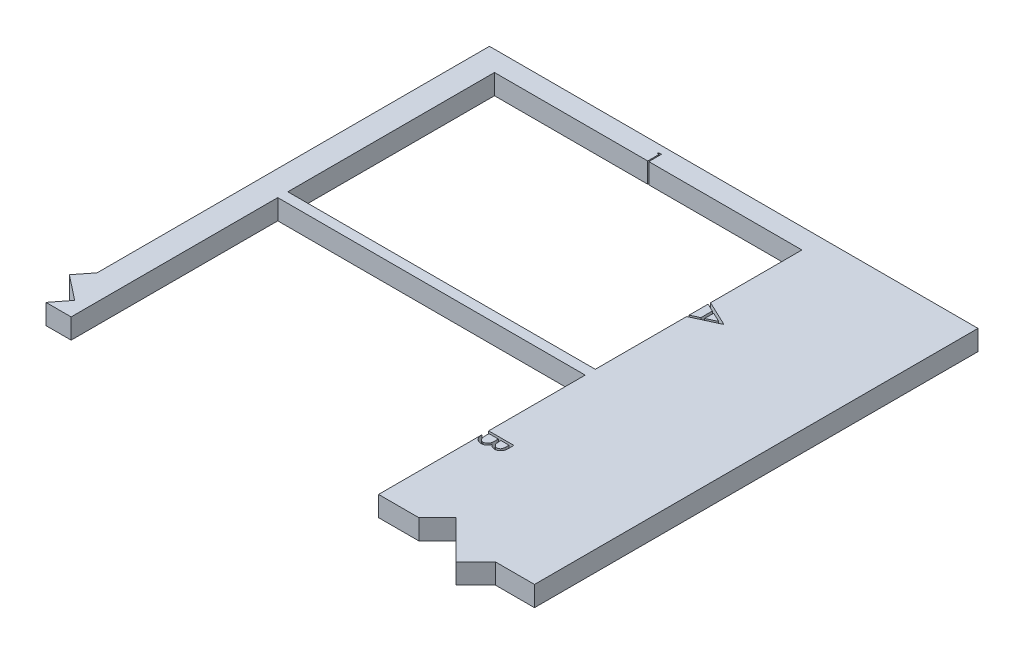
from build123d import *

# Parameters (mm, degrees)
SKETCH1_W           = 77.47
SKETCH1_H           = 52.07
BOSS_EXTRUDE4_DEPTH = 5.08
CUT_EXTRUDE9_DEPTH  = 5.08
CUT_EXTRUDE20_DEPTH = 5.08


with BuildPart() as part:
    # Sketch1 → Boss-Extrude4 (new body)
    with BuildSketch(Plane(origin=(0, 0, 0), x_dir=(1, 0, 0), z_dir=(0, 1, 0))):
        Polygon((-146.05, -110.49), (-151.207591036, -110.49), (-151.207591036, 110.49), (151.052408964, 110.49), (151.052408964, -110.49), (111.76, -110.49), (111.76, -58.42), (34.29, -58.42), (34.29, -110.49), (21.59, -110.49), (21.59, -58.42), (-55.88, -58.42), (-55.88, -110.49), (-68.58, -110.49), (-68.58, -58.42), (-146.05, -58.42), align=None)
        with Locations((-107.315, 79.375)):
            Rectangle(SKETCH1_W, SKETCH1_H, mode=Mode.SUBTRACT)
        with Locations((-107.315, 24.765)):
            Rectangle(SKETCH1_W, SKETCH1_H, mode=Mode.SUBTRACT)
        with Locations((-107.315, -29.845)):
            Rectangle(SKETCH1_W, SKETCH1_H, mode=Mode.SUBTRACT)
        with Locations((-17.145, 79.375)):
            Rectangle(SKETCH1_W, SKETCH1_H, mode=Mode.SUBTRACT)
        with Locations((73.025, 79.375)):
            Rectangle(SKETCH1_W, SKETCH1_H, mode=Mode.SUBTRACT)
        with Locations((-17.145, 24.765)):
            Rectangle(SKETCH1_W, SKETCH1_H, mode=Mode.SUBTRACT)
        with Locations((-17.145, -29.845)):
            Rectangle(SKETCH1_W, SKETCH1_H, mode=Mode.SUBTRACT)
        with Locations((73.025, 24.765)):
            Rectangle(SKETCH1_W, SKETCH1_H, mode=Mode.SUBTRACT)
        with Locations((73.025, -29.845)):
            Rectangle(SKETCH1_W, SKETCH1_H, mode=Mode.SUBTRACT)
    extrude(amount=BOSS_EXTRUDE4_DEPTH)

    # Sketch8 → Cut-Extrude9 (cut)
    # profile 1 of 7: a face of its own
    with BuildSketch(Plane(origin=(0, 5.08, 0), x_dir=(1, 0, 0), z_dir=(0, 1, 0))):
        Polygon((118.11, 79.293589744), (111.76, 76.362820513), (111.76, 76.982301683), (113.79525641, 77.921063702), (113.79525641, 80.799679487), (111.76, 81.765154247), (111.76, 82.387179487), (118.11, 79.375), align=None)
        Polygon((116.872309696, 79.340655048), (114.446538462, 80.49057492), (114.446538462, 78.221264022), align=None, mode=Mode.SUBTRACT)
    # profile 2 of 7: a face of its own
    with BuildSketch(Plane(origin=(0, 5.08, 0), x_dir=(1, 0, 0), z_dir=(0, 1, 0))):
        with BuildLine():
            Line((118.11, 26.474615385), (118.11, 25.235653045))
            add(Edge.make_bspline(
                [(118.11, 25.235653045), (118.109681139, 25.175004234), (118.109063106, 25.057451746), (118.099477996, 24.886510758), (118.086408481, 24.726402202), (118.065671027, 24.577079644), (118.040648803, 24.438612083), (118.010346937, 24.310582227), (117.974012938, 24.193397201), (117.916234684, 24.053492664), (117.830376936, 23.893979465), (117.703506539, 23.721262382), (117.548326213, 23.573571833), (117.37327911, 23.4462338), (117.180718496, 23.344994626), (116.975233967, 23.271753187), (116.75947595, 23.225383899), (116.611351899, 23.220615168), (116.536492388, 23.218205128)],
                knots=[0, 0, 0, 0, 1.001505555, 1.941167018, 2.826882275, 3.653841531, 4.429895133, 5.150066043, 5.825578002, 6.45369114, 7.647487171, 8.808567382, 9.977351308, 11.170798116, 12.373658725, 13.556498008, 14.765093433, 16, 16, 16, 16], degree=3))
            add(Edge.make_bspline(
                [(116.536492388, 23.218205128), (116.466353726, 23.220150205), (116.328524642, 23.223972465), (116.12725909, 23.261767034), (115.934882118, 23.318037757), (115.753765338, 23.399726219), (115.586236491, 23.504802861), (115.433291194, 23.631250472), (115.29863595, 23.781802882), (115.223670167, 23.894781468), (115.185590946, 23.952169471)],
                knots=[0, 0, 0, 0, 1.044266239, 2.052081639, 3.041743201, 4.026043445, 5.00270663, 5.980942822, 6.97441044, 8, 8, 8, 8], degree=3))
            add(Edge.make_bspline(
                [(115.185590946, 23.952169471), (115.157917248, 23.880020614), (115.10497061, 23.741981978), (115.010852235, 23.551885993), (114.90963819, 23.387448746), (114.798522364, 23.248489243), (114.677253559, 23.131437365), (114.548260115, 23.026322349), (114.405191505, 22.938259533), (114.252121508, 22.862606152), (114.090124446, 22.803067733), (113.919941192, 22.760940396), (113.743474705, 22.735055197), (113.623194862, 22.731525492), (113.562473958, 22.72974359)],
                knots=[0, 0, 0, 0, 1.272302504, 2.434229863, 3.488457646, 4.447234501, 5.35599188, 6.26022912, 7.18267843, 8.11661068, 9.06895546, 10.019249207, 11.000057067, 12, 12, 12, 12], degree=3))
            add(Edge.make_bspline(
                [(113.562473958, 22.72974359), (113.500485842, 22.731516424), (113.378522486, 22.735004524), (113.199347436, 22.7607231), (113.028142769, 22.804311677), (112.863691196, 22.864204763), (112.70692357, 22.942816916), (112.555876508, 23.036423505), (112.414573802, 23.150354586), (112.279655118, 23.277346904), (112.158418428, 23.421179366), (112.05048411, 23.576340817), (111.961311987, 23.745062992), (111.887341532, 23.924729456), (111.830014808, 24.116534097), (111.790215937, 24.31976575), (111.763336967, 24.53446858), (111.761131196, 24.681807332), (111.76, 24.757367788)],
                knots=[0, 0, 0, 0, 0.978404568, 1.925038397, 2.85041836, 3.763147166, 4.682162379, 5.614488577, 6.562659439, 7.54271123, 8.535210642, 9.526693784, 10.520907202, 11.541451354, 12.589717429, 13.675358278, 14.807842563, 16, 16, 16, 16], degree=3))
            Line((111.76, 24.757367788), (111.76, 26.474615385))
            Line((111.76, 26.474615385), (118.11, 26.474615385))
        make_face()
        with BuildLine():
            Line((117.458717949, 25.90474359), (115.423461538, 25.90474359))
            Line((115.423461538, 25.90474359), (115.423461538, 25.521860978))
            add(Edge.make_bspline(
                [(115.423461538, 25.521860978), (115.424181075, 25.465891945), (115.425571367, 25.357748368), (115.429679415, 25.200723225), (115.440678409, 25.055331233), (115.452311659, 24.921071395), (115.470224485, 24.798843581), (115.49214475, 24.688238604), (115.515124768, 24.588262886), (115.554315522, 24.473021329), (115.611648095, 24.342338932), (115.702715767, 24.203911992), (115.808237502, 24.079896012), (115.932241327, 23.976344233), (116.067626032, 23.890895914), (116.214403686, 23.833871415), (116.366844139, 23.793424687), (116.471770578, 23.789877771), (116.525044071, 23.788076923)],
                knots=[0, 0, 0, 0, 1.156481963, 2.23455883, 3.244418989, 4.168404366, 5.01828131, 5.794834307, 6.498111525, 7.13526334, 8.307595709, 9.435046769, 10.546766856, 11.659452936, 12.760769924, 13.837671619, 14.902137667, 16, 16, 16, 16], degree=3))
            add(Edge.make_bspline(
                [(116.525044071, 23.788076923), (116.56030457, 23.788977603), (116.629471889, 23.790744385), (116.729913527, 23.8068242), (116.82558773, 23.830156168), (116.914294057, 23.866607821), (116.998553798, 23.910685404), (117.074624411, 23.96802234), (117.1466735, 24.032775181), (117.212055599, 24.108821091), (117.270638216, 24.195791849), (117.322185781, 24.294516129), (117.362847974, 24.406172748), (117.399324126, 24.528230019), (117.4246346, 24.66264136), (117.445797527, 24.808093389), (117.456555228, 24.965820019), (117.457980962, 25.074940101), (117.458717949, 25.131346154)],
                knots=[0, 0, 0, 0, 0.911752476, 1.788502045, 2.626783689, 3.45400582, 4.26402138, 5.080402872, 5.911472738, 6.767166405, 7.66795952, 8.620018292, 9.640966946, 10.73819047, 11.913090943, 13.176185384, 14.540321519, 16, 16, 16, 16], degree=3))
            Line((117.458717949, 25.131346154), (117.458717949, 25.90474359))
        make_face(mode=Mode.SUBTRACT)
        with BuildLine():
            Line((114.772179487, 25.90474359), (112.411282051, 25.90474359))
            Line((112.411282051, 25.90474359), (112.411282051, 25.093185096))
            add(Edge.make_bspline(
                [(112.411282051, 25.093185096), (112.411975847, 25.035093328), (112.413313047, 24.923129104), (112.417726104, 24.761477849), (112.427553327, 24.612056238), (112.443574322, 24.47477829), (112.460221531, 24.348435585), (112.483262073, 24.23428334), (112.509456384, 24.132146551), (112.549993321, 24.013731405), (112.612860676, 23.880302727), (112.708268617, 23.736613475), (112.820435778, 23.607586425), (112.95189156, 23.499274679), (113.093745082, 23.409835086), (113.245254404, 23.347105881), (113.401797428, 23.306771901), (113.508807295, 23.302005692), (113.562473958, 23.299615385)],
                knots=[0, 0, 0, 0, 1.159821618, 2.235403267, 3.228114831, 4.14795534, 4.994323282, 5.771256229, 6.471395042, 7.097801288, 8.267864287, 9.404187171, 10.531774336, 11.667624178, 12.792825787, 13.866573821, 14.930062559, 16, 16, 16, 16], degree=3))
            add(Edge.make_bspline(
                [(113.562473958, 23.299615385), (113.596030503, 23.300103956), (113.662602321, 23.301073218), (113.760357737, 23.31624054), (113.855472736, 23.337399943), (113.946509043, 23.368040578), (114.034948011, 23.406675936), (114.119249173, 23.455161844), (114.2014282, 23.511153881), (114.305201688, 23.598743929), (114.42480707, 23.726024945), (114.541892162, 23.906931894), (114.636322991, 24.112618706), (114.676417579, 24.261803289), (114.697129407, 24.338868189)],
                knots=[0, 0, 0, 0, 0.723503378, 1.435336582, 2.130201219, 2.824764462, 3.504949994, 4.209866579, 4.920640069, 5.648298893, 7.13757748, 8.670694625, 10.280166878, 12, 12, 12, 12], degree=3))
            add(Edge.make_bspline(
                [(114.697129407, 24.338868189), (114.703398338, 24.369763806), (114.716990673, 24.436751875), (114.731329404, 24.545986183), (114.744191712, 24.671110852), (114.753456167, 24.811591078), (114.763401398, 24.967985569), (114.767131466, 25.140244081), (114.771684212, 25.328488394), (114.772010172, 25.459103286), (114.772179487, 25.526949119)],
                knots=[0, 0, 0, 0, 0.634452549, 1.375623993, 2.216454381, 3.166361212, 4.209414599, 5.370755378, 6.634280627, 8, 8, 8, 8], degree=3))
            Line((114.772179487, 25.526949119), (114.772179487, 25.90474359))
        make_face(mode=Mode.SUBTRACT)
    # profile 3 of 7: a face of its own
    with BuildSketch(Plane(origin=(0, 5.08, 0), x_dir=(1, 0, 0), z_dir=(0, 1, 0))):
        with BuildLine():
            Line((116.944815705, -32.938589744), (116.563205128, -32.439951923))
            add(Edge.make_bspline(
                [(116.563205128, -32.439951923), (116.605597673, -32.40438124), (116.689811221, -32.333719444), (116.808065537, -32.220037748), (116.918855368, -32.10156191), (117.022708493, -31.978337218), (117.115993196, -31.848145673), (117.203570769, -31.714141081), (117.282070808, -31.574081771), (117.377253654, -31.380403623), (117.476578821, -31.127042527), (117.559860398, -30.808100462), (117.612875959, -30.475158898), (117.618617886, -30.248014681), (117.621538462, -30.132479968)],
                knots=[0, 0, 0, 0, 0.757959112, 1.505699292, 2.245454638, 2.979532153, 3.711538275, 4.438200793, 5.171680507, 5.909471876, 7.393775596, 8.890124382, 10.418191784, 12, 12, 12, 12], degree=3))
            add(Edge.make_bspline(
                [(117.621538462, -30.132479968), (117.620802251, -30.068829613), (117.619336663, -29.942119638), (117.600137483, -29.754060275), (117.572842033, -29.56915638), (117.533326202, -29.388095544), (117.481880175, -29.211237272), (117.421547717, -29.037234935), (117.346470096, -28.868137816), (117.263556886, -28.701910874), (117.169880198, -28.542661658), (117.067735433, -28.391952614), (116.958125128, -28.250472259), (116.84133222, -28.117828549), (116.715905207, -27.995476207), (116.58331959, -27.881454356), (116.441979536, -27.777817938), (116.294535759, -27.682020268), (116.140771545, -27.596777475), (115.9816542, -27.523166197), (115.817792087, -27.46007521), (115.648849522, -27.409690045), (115.475491338, -27.369948117), (115.297349628, -27.342492588), (115.114770175, -27.323466123), (114.991019157, -27.322014016), (114.928639824, -27.321282051)],
                knots=[0, 0, 0, 0, 1.055000685, 2.100209969, 3.131349012, 4.153242145, 5.170189196, 6.184191144, 7.204341339, 8.235672124, 9.263040994, 10.265373269, 11.252624173, 12.22887325, 13.193405896, 14.155809299, 15.126090485, 16.097288279, 17.069732292, 18.038585918, 19.002221264, 19.978698174, 20.959418239, 21.948869816, 22.966084182, 24, 24, 24, 24], degree=3))
            add(Edge.make_bspline(
                [(114.928639824, -27.321282051), (114.834784429, -27.323571352), (114.650511811, -27.328066089), (114.380599417, -27.368068066), (114.122026195, -27.428855875), (113.876408481, -27.519961279), (113.640717603, -27.632300128), (113.418941397, -27.774250951), (113.207728487, -27.938655241), (113.012070568, -28.12783883), (112.833338524, -28.335403668), (112.675948183, -28.55810345), (112.544748325, -28.795383515), (112.435571964, -29.044623973), (112.351649044, -29.307742779), (112.29256842, -29.584266778), (112.254029036, -29.873594541), (112.250339344, -30.071296166), (112.248461538, -30.171913061)],
                knots=[0, 0, 0, 0, 1.029171465, 2.020641659, 2.987623507, 3.938342917, 4.889210282, 5.84687017, 6.821220943, 7.821438502, 8.827599549, 9.822697543, 10.807740252, 11.797342354, 12.80366471, 13.83203677, 14.896651826, 16, 16, 16, 16], degree=3))
            add(Edge.make_bspline(
                [(112.248461538, -30.171913061), (112.251525467, -30.282770797), (112.257556013, -30.50096534), (112.308644936, -30.820947331), (112.391481444, -31.127263648), (112.507410532, -31.41993077), (112.658114697, -31.698123628), (112.840809417, -31.962277569), (113.057232535, -32.212615561), (113.222483354, -32.363149173), (113.306794872, -32.439951923)],
                knots=[0, 0, 0, 0, 1.028121516, 2.023589091, 2.998037872, 3.967518031, 4.937445131, 5.927275754, 6.942489185, 8, 8, 8, 8], degree=3))
            Line((113.306794872, -32.439951923), (112.929000401, -32.938589744))
            add(Edge.make_bspline(
                [(112.929000401, -32.938589744), (112.877223407, -32.898461226), (112.773917427, -32.818396404), (112.628282924, -32.688750355), (112.491292127, -32.552178781), (112.36407883, -32.407649584), (112.243987323, -32.256891333), (112.135043577, -32.097248498), (112.033928993, -31.93147842), (111.942568033, -31.758615962), (111.860652906, -31.579228654), (111.791497891, -31.393503181), (111.731069307, -31.20301302), (111.681684053, -31.007662239), (111.643076564, -30.806798224), (111.617282312, -30.601110145), (111.599606535, -30.390163816), (111.597995761, -30.247848605), (111.597179487, -30.175729167)],
                knots=[0, 0, 0, 0, 0.986756325, 1.968786143, 2.935506311, 3.899499537, 4.868307269, 5.8376204, 6.809456583, 7.792545619, 8.781780509, 9.778496008, 10.776623214, 11.79151764, 12.812666265, 13.856269958, 14.913646641, 16, 16, 16, 16], degree=3))
            add(Edge.make_bspline(
                [(111.597179487, -30.175729167), (111.597654817, -30.107432799), (111.598594721, -29.97238519), (111.613820511, -29.772997455), (111.634593605, -29.578887787), (111.665872129, -29.390610966), (111.702782574, -29.207139554), (111.752260425, -29.030136779), (111.807685342, -28.857860898), (111.872827246, -28.691004051), (111.946335178, -28.52942431), (112.029414149, -28.373642823), (112.121365532, -28.223731239), (112.220162479, -28.07821569), (112.328978441, -27.939245788), (112.446302192, -27.805617249), (112.571738298, -27.676580756), (112.662189246, -27.596747314), (112.707666266, -27.556608574)],
                knots=[0, 0, 0, 0, 1.114604814, 2.203992996, 3.262667896, 4.300477797, 5.318619304, 6.316056647, 7.298880507, 8.271930387, 9.238335007, 10.195173496, 11.151986948, 12.108099108, 13.064862484, 14.031167946, 15.010108607, 16, 16, 16, 16], degree=3))
            add(Edge.make_bspline(
                [(112.707666266, -27.556608574), (112.786662423, -27.492318192), (112.943701026, -27.364513598), (113.198219878, -27.200999858), (113.463955057, -27.061032151), (113.742302642, -26.947864409), (114.032638045, -26.859394879), (114.335107621, -26.798106139), (114.649428887, -26.758279657), (114.86321849, -26.753725276), (114.971889022, -26.751410256)],
                knots=[0, 0, 0, 0, 0.994628077, 1.977248131, 2.950237994, 3.925870899, 4.908910175, 5.911660606, 6.938484602, 8, 8, 8, 8], degree=3))
            add(Edge.make_bspline(
                [(114.971889022, -26.751410256), (115.086103424, -26.754244442), (115.310813128, -26.759820525), (115.640671219, -26.806804203), (115.956243845, -26.883302707), (116.258745252, -26.988641657), (116.546444643, -27.127611896), (116.820557094, -27.295846609), (117.080858784, -27.494989044), (117.324021732, -27.72253816), (117.546337205, -27.97213776), (117.741930009, -28.239412742), (117.904702809, -28.523860895), (118.040767384, -28.82234304), (118.145350881, -29.137095699), (118.218563099, -29.467446937), (118.264132722, -29.812776116), (118.269893457, -30.048383659), (118.272820513, -30.168096955)],
                knots=[0, 0, 0, 0, 1.032901378, 2.032168977, 3.007206631, 3.966850309, 4.924221947, 5.891988639, 6.871730993, 7.884084801, 8.900290346, 9.89161143, 10.874607481, 11.860025555, 12.854717796, 13.869097222, 14.917278314, 16, 16, 16, 16], degree=3))
            add(Edge.make_bspline(
                [(118.272820513, -30.168096955), (118.27194643, -30.24105764), (118.270216271, -30.385475968), (118.253322795, -30.599110851), (118.225211517, -30.807112405), (118.186697164, -31.009983654), (118.139491479, -31.208460249), (118.077695589, -31.40050597), (118.005935411, -31.587166578), (117.925394904, -31.768581871), (117.833318651, -31.942778105), (117.733314188, -32.109723579), (117.623073079, -32.267404402), (117.506239897, -32.418786561), (117.378444314, -32.560461963), (117.243848093, -32.696476823), (117.098457292, -32.822132675), (116.996123317, -32.89969966), (116.944815705, -32.938589744)],
                knots=[0, 0, 0, 0, 1.096705196, 2.170817488, 3.219277236, 4.250701065, 5.274195539, 6.284202015, 7.28098643, 8.279664616, 9.266225751, 10.241373748, 11.203306326, 12.157093976, 13.114198862, 14.069774147, 15.032234603, 16, 16, 16, 16], degree=3))
        make_face()
    # profile 4 of 7: a face of its own
    with BuildSketch(Plane(origin=(0, 5.08, 0), x_dir=(1, 0, 0), z_dir=(0, 1, 0))):
        with BuildLine():
            Line((111.76, -82.012692308), (118.11, -82.012692308))
            Line((118.11, -82.012692308), (118.11, -83.294903846))
            add(Edge.make_bspline(
                [(118.11, -83.294903846), (118.10919924, -83.406426385), (118.107652175, -83.62188735), (118.097786915, -83.933238257), (118.080511466, -84.220906485), (118.054862343, -84.484728674), (118.024076207, -84.725128674), (117.984923928, -84.941721457), (117.938878197, -85.134858028), (117.899605318, -85.253638066), (117.881033654, -85.309807692)],
                knots=[0, 0, 0, 0, 1.314317071, 2.539253741, 3.67075822, 4.709970291, 5.662644612, 6.526156501, 7.303037452, 8, 8, 8, 8], degree=3))
            add(Edge.make_bspline(
                [(117.881033654, -85.309807692), (117.853037914, -85.383276673), (117.797681284, -85.528548601), (117.693258165, -85.735390771), (117.574941266, -85.930107124), (117.44258475, -86.11375686), (117.2924032, -86.282089414), (117.130916153, -86.441891296), (116.951524797, -86.585988874), (116.760320009, -86.720164865), (116.555362101, -86.837571052), (116.340810785, -86.941109671), (116.117067511, -87.029513574), (115.882503759, -87.098492965), (115.639371325, -87.15548169), (115.385829701, -87.193719768), (115.123356971, -87.219119775), (114.945238152, -87.221659883), (114.854861779, -87.222948718)],
                knots=[0, 0, 0, 0, 0.98467389, 1.947018643, 2.898343565, 3.837828625, 4.779009928, 5.722093987, 6.681368302, 7.658573986, 8.646467994, 9.637429229, 10.641859304, 11.657149908, 12.698561448, 13.768651538, 14.867827761, 16, 16, 16, 16], degree=3))
            add(Edge.make_bspline(
                [(114.854861779, -87.222948718), (114.776373797, -87.221806822), (114.621705032, -87.219556598), (114.39375275, -87.199375846), (114.172580583, -87.169987158), (113.959159893, -87.124695693), (113.752052982, -87.069043404), (113.552243376, -87.000351318), (113.359584615, -86.918944546), (113.175646042, -86.82449634), (113.000731948, -86.721221421), (112.837852299, -86.607986514), (112.683909336, -86.491289421), (112.545846691, -86.362132049), (112.415768103, -86.229414775), (112.300701958, -86.08609986), (112.195636064, -85.936856417), (112.101337325, -85.778809783), (112.019522725, -85.608171823), (111.94943361, -85.422613554), (111.891722261, -85.221141181), (111.843495333, -85.004063511), (111.805260876, -84.770955192), (111.779629867, -84.521602395), (111.762298604, -84.256383924), (111.760781079, -84.074267288), (111.76, -83.980530849)],
                knots=[0, 0, 0, 0, 1.105818345, 2.179130549, 3.222742436, 4.24813173, 5.251184997, 6.243232575, 7.223185975, 8.195898781, 9.155064964, 10.083206407, 10.990357329, 11.874224667, 12.744762365, 13.607037788, 14.46074101, 15.315384698, 16.197310979, 17.123950979, 18.107232398, 19.148086642, 20.256146639, 21.433991621, 22.679261309, 24, 24, 24, 24], degree=3))
            Line((111.76, -83.980530849), (111.76, -82.012692308))
        make_face()
        with BuildLine():
            Line((112.411282051, -82.582564103), (112.411282051, -83.311440304))
            add(Edge.make_bspline(
                [(112.411282051, -83.311440304), (112.411732169, -83.416176063), (112.41259791, -83.617621283), (112.420194693, -83.907286506), (112.432607922, -84.171953411), (112.449979849, -84.411659579), (112.472964337, -84.626269665), (112.498590946, -84.816232183), (112.53051775, -84.980924438), (112.559457347, -85.08058213), (112.572830529, -85.126634615)],
                knots=[0, 0, 0, 0, 1.375205317, 2.645023457, 3.804390687, 4.853969522, 5.800190428, 6.637939096, 7.370582563, 8, 8, 8, 8], degree=3))
            add(Edge.make_bspline(
                [(112.572830529, -85.126634615), (112.593242549, -85.184599298), (112.633579048, -85.299144178), (112.707184232, -85.464010709), (112.794265109, -85.61784952), (112.891632722, -85.763227177), (113.000795015, -85.899202305), (113.122082386, -86.02517169), (113.254153497, -86.142030641), (113.397503093, -86.248500834), (113.551204387, -86.34363756), (113.713300631, -86.426559757), (113.883400607, -86.496918019), (114.062117399, -86.554129451), (114.249282549, -86.598465023), (114.444403664, -86.63000926), (114.647541614, -86.649619319), (114.785702691, -86.651909464), (114.856133814, -86.653076923)],
                knots=[0, 0, 0, 0, 0.998463025, 1.973077781, 2.929496817, 3.867873318, 4.813809365, 5.759268434, 6.706333209, 7.676553387, 8.657505312, 9.640584699, 10.632319813, 11.645628493, 12.686877747, 13.755137172, 14.855624085, 16, 16, 16, 16], degree=3))
            add(Edge.make_bspline(
                [(114.856133814, -86.653076923), (114.930398398, -86.652144681), (115.07629183, -86.650313282), (115.290366967, -86.627332533), (115.49623045, -86.593678155), (115.694030492, -86.545268959), (115.88350975, -86.482728451), (116.065738702, -86.407893664), (116.238372234, -86.317032486), (116.402872487, -86.214168026), (116.556748208, -86.098683831), (116.698196661, -85.971092184), (116.827481331, -85.832738462), (116.94480806, -85.684260293), (117.048090353, -85.523581703), (117.139968669, -85.353421689), (117.218033951, -85.17138332), (117.259539698, -85.044720759), (117.280633013, -84.980350561)],
                knots=[0, 0, 0, 0, 1.122272916, 2.204715076, 3.251197285, 4.274229216, 5.279697671, 6.265416158, 7.248880903, 8.225321784, 9.195852973, 10.153576302, 11.101466393, 12.055578741, 13.010401466, 13.985536859, 14.976245305, 16, 16, 16, 16], degree=3))
            add(Edge.make_bspline(
                [(117.280633013, -84.980350561), (117.295358532, -84.927099195), (117.326669026, -84.813872182), (117.36082363, -84.629106297), (117.390948936, -84.421161669), (117.416454236, -84.189115068), (117.434755519, -83.933231006), (117.448492047, -83.653312687), (117.457756937, -83.349239119), (117.458389591, -83.138450807), (117.458717949, -83.029048478)],
                knots=[0, 0, 0, 0, 0.674548936, 1.434276114, 2.292660221, 3.240891867, 4.284742987, 5.42552168, 6.663806718, 8, 8, 8, 8], degree=3))
            Line((117.458717949, -83.029048478), (117.458717949, -82.582564103))
            Line((117.458717949, -82.582564103), (112.411282051, -82.582564103))
        make_face(mode=Mode.SUBTRACT)
    # profile 5 of 7: a face of its own
    with BuildSketch(Plane(origin=(0, 5.08, 0), x_dir=(1, 0, 0), z_dir=(0, 1, 0))):
        with BuildLine():
            Line((-108.006987179, 107.852307692), (-108.291923077, 107.852307692))
            add(Edge.make_bspline(
                [(-108.291923077, 107.852307692), (-108.284203699, 107.884268588), (-108.269112946, 107.946749526), (-108.23763729, 108.03601897), (-108.203347966, 108.120495307), (-108.162173564, 108.198596746), (-108.117262051, 108.271892893), (-108.065806439, 108.338721313), (-108.010180691, 108.400781646), (-107.948653773, 108.455857226), (-107.884129915, 108.50572988), (-107.815699939, 108.548252254), (-107.7447406, 108.584832021), (-107.670760258, 108.614967517), (-107.593538659, 108.637669242), (-107.513773929, 108.654140059), (-107.43125704, 108.664836284), (-107.375243154, 108.66588019), (-107.346800881, 108.666410256)],
                knots=[0, 0, 0, 0, 1.162005537, 2.271625781, 3.343758855, 4.383309926, 5.390229558, 6.379919256, 7.361854164, 8.333198761, 9.295911338, 10.242430842, 11.177959212, 12.116337295, 13.062827104, 14.020064771, 14.994644689, 16, 16, 16, 16], degree=3))
            add(Edge.make_bspline(
                [(-107.346800881, 108.666410256), (-107.305360108, 108.665159098), (-107.223382505, 108.662684071), (-107.102947456, 108.640083118), (-106.986808841, 108.604318891), (-106.876237881, 108.554903438), (-106.773532588, 108.493954947), (-106.682150476, 108.421415507), (-106.603330184, 108.338684712), (-106.53720457, 108.247305886), (-106.485429392, 108.14964696), (-106.447251039, 108.049135389), (-106.424008514, 107.9460096), (-106.420996295, 107.876379783), (-106.419487179, 107.841495393)],
                knots=[0, 0, 0, 0, 1.083050992, 2.142477498, 3.193116406, 4.255571735, 5.30263384, 6.308962982, 7.297363603, 8.282367274, 9.249857812, 10.179914175, 11.08814088, 12, 12, 12, 12], degree=3))
            add(Edge.make_bspline(
                [(-106.419487179, 107.841495393), (-106.420542723, 107.807924943), (-106.422608257, 107.742232783), (-106.44014669, 107.646328282), (-106.469661729, 107.555939116), (-106.510546442, 107.470684776), (-106.563470562, 107.391105814), (-106.627580795, 107.317023185), (-106.703329638, 107.248108306), (-106.760732674, 107.208629927), (-106.790285457, 107.188305288)],
                knots=[0, 0, 0, 0, 1.024540389, 2.004866551, 2.965041327, 3.920577974, 4.882998113, 5.874504559, 6.905732034, 8, 8, 8, 8], degree=3))
            add(Edge.make_bspline(
                [(-106.790285457, 107.188305288), (-106.756510937, 107.171996519), (-106.689593843, 107.139684128), (-106.598380149, 107.076314977), (-106.515578076, 107.003148148), (-106.469401131, 106.94605017), (-106.44619992, 106.917361779)],
                knots=[0, 0, 0, 0, 1.015518401, 2.012035669, 3.001164323, 4, 4, 4, 4], degree=3))
            add(Edge.make_bspline(
                [(-106.44619992, 106.917361779), (-106.430922416, 106.896445104), (-106.400617589, 106.85495428), (-106.363211069, 106.788246236), (-106.329275659, 106.720798814), (-106.302832245, 106.65080421), (-106.282354523, 106.57907369), (-106.267716837, 106.505484088), (-106.258623509, 106.429975311), (-106.257321258, 106.378891847), (-106.256666667, 106.353214143)],
                knots=[0, 0, 0, 0, 1.025084078, 2.033381695, 3.024893161, 4.013698104, 4.991890475, 5.976764909, 6.982997093, 8, 8, 8, 8], degree=3))
            add(Edge.make_bspline(
                [(-106.256666667, 106.353214143), (-106.258294547, 106.308755324), (-106.261542646, 106.220046911), (-106.290574914, 106.088987699), (-106.335581211, 105.960875994), (-106.399495717, 105.838343818), (-106.477389814, 105.723698758), (-106.570061101, 105.621122392), (-106.676456629, 105.532949372), (-106.795116039, 105.459280094), (-106.923673719, 105.400390265), (-107.061174435, 105.359516727), (-107.205636984, 105.332895713), (-107.304703604, 105.330041054), (-107.355069111, 105.328589744)],
                knots=[0, 0, 0, 0, 0.955779014, 1.907060117, 2.875433937, 3.871313158, 4.872415639, 5.851225146, 6.836215519, 7.83643374, 8.849228613, 9.86973379, 10.916971861, 12, 12, 12, 12], degree=3))
            add(Edge.make_bspline(
                [(-107.355069111, 105.328589744), (-107.389013762, 105.329377337), (-107.455805515, 105.330927058), (-107.553997832, 105.341521218), (-107.647725373, 105.36087058), (-107.737114866, 105.386908578), (-107.82224572, 105.419921087), (-107.902858158, 105.46103162), (-107.979448133, 105.509392769), (-108.051292896, 105.565575381), (-108.118383883, 105.628423453), (-108.17893814, 105.699052698), (-108.233965237, 105.776157486), (-108.281991774, 105.860633401), (-108.325205295, 105.951388741), (-108.36074802, 106.049585593), (-108.392031357, 106.154346099), (-108.406576, 106.227350906), (-108.414038462, 106.264807692)],
                knots=[0, 0, 0, 0, 1.048658725, 2.063410685, 3.046034179, 4.001477787, 4.936774919, 5.862367409, 6.792675028, 7.730719943, 8.675894397, 9.627829632, 10.600096036, 11.597688215, 12.626045268, 13.701542398, 14.82072376, 16, 16, 16, 16], degree=3))
            Line((-108.414038462, 106.264807692), (-108.129102564, 106.264807692))
            add(Edge.make_bspline(
                [(-108.129102564, 106.264807692), (-108.12167915, 106.240361087), (-108.107239964, 106.192810317), (-108.082661565, 106.124375183), (-108.054659633, 106.061638949), (-108.024619997, 106.004141403), (-107.993070978, 105.951316295), (-107.957769582, 105.904560456), (-107.921330429, 105.861820237), (-107.89386273, 105.837740482), (-107.880419671, 105.825955529)],
                knots=[0, 0, 0, 0, 1.198163088, 2.33053128, 3.407730985, 4.417276592, 5.372219308, 6.28897303, 7.162600585, 8, 8, 8, 8], degree=3))
            add(Edge.make_bspline(
                [(-107.880419671, 105.825955529), (-107.862642777, 105.812250112), (-107.827143861, 105.784881583), (-107.769296966, 105.749955106), (-107.708459534, 105.71969189), (-107.643313365, 105.696574537), (-107.575264252, 105.677000516), (-107.503212285, 105.664191188), (-107.427793138, 105.655402633), (-107.376296667, 105.654627088), (-107.34998097, 105.654230769)],
                knots=[0, 0, 0, 0, 0.946170439, 1.889420265, 2.845303464, 3.807233317, 4.801018734, 5.828864929, 6.890507805, 8, 8, 8, 8], degree=3))
            add(Edge.make_bspline(
                [(-107.34998097, 105.654230769), (-107.320268864, 105.654789483), (-107.262169405, 105.655882), (-107.177392497, 105.665929249), (-107.096740741, 105.680561838), (-107.021109587, 105.703161472), (-106.949508341, 105.731084102), (-106.882940702, 105.766143727), (-106.820532806, 105.807277867), (-106.763083988, 105.854031247), (-106.711426277, 105.905213603), (-106.665942576, 105.958746889), (-106.627275919, 106.014405392), (-106.596085101, 106.072497116), (-106.571455674, 106.132781502), (-106.55468877, 106.195427726), (-106.54303061, 106.259923103), (-106.542081183, 106.303764382), (-106.541602564, 106.325865385)],
                knots=[0, 0, 0, 0, 1.217147791, 2.380027433, 3.494444702, 4.572153297, 5.609568379, 6.639424714, 7.649109417, 8.668170816, 9.669597737, 10.625200337, 11.543417969, 12.441394052, 13.322311151, 14.205496177, 15.095365482, 16, 16, 16, 16], degree=3))
            add(Edge.make_bspline(
                [(-106.541602564, 106.325865385), (-106.542990766, 106.355448528), (-106.545760263, 106.414467612), (-106.566904474, 106.501297126), (-106.601683301, 106.584956936), (-106.650371936, 106.664019688), (-106.709640776, 106.737294971), (-106.778914656, 106.802674101), (-106.858768834, 106.856621969), (-106.93226543, 106.893895251), (-106.997366679, 106.919328883), (-107.053079206, 106.936269744), (-107.115451268, 106.950614988), (-107.183728599, 106.96396112), (-107.258425659, 106.975319772), (-107.339461128, 106.984791991), (-107.426851426, 106.992371206), (-107.487349841, 106.995755843), (-107.518525641, 106.9975)],
                knots=[0, 0, 0, 0, 1.07054697, 2.135767047, 3.216561865, 4.33974944, 5.486079747, 6.621378074, 7.775625952, 8.963672916, 9.598146892, 10.304877434, 11.070270905, 11.915000392, 12.823868403, 13.805723172, 14.86925407, 16, 16, 16, 16], degree=3))
            Line((-107.518525641, 106.9975), (-107.518525641, 107.323141026))
            add(Edge.make_bspline(
                [(-107.518525641, 107.323141026), (-107.479245298, 107.323807598), (-107.402304755, 107.325113248), (-107.289914921, 107.340904801), (-107.182442702, 107.36274937), (-107.082269872, 107.396209509), (-106.990967111, 107.435071778), (-106.911755757, 107.480294854), (-106.84574556, 107.530563948), (-106.793257302, 107.586654958), (-106.753770073, 107.64681218), (-106.724898621, 107.709510862), (-106.707844039, 107.775300546), (-106.705567413, 107.82019928), (-106.704423077, 107.842767428)],
                knots=[0, 0, 0, 0, 1.321986639, 2.589447074, 3.816329219, 5.01088745, 6.139805852, 7.153945165, 8.075214402, 8.924034688, 9.728124013, 10.488707548, 11.240355623, 12, 12, 12, 12], degree=3))
            add(Edge.make_bspline(
                [(-106.704423077, 107.842767428), (-106.704799007, 107.859347954), (-106.705546902, 107.892334124), (-106.714978718, 107.94052615), (-106.729151955, 107.987244866), (-106.748637138, 108.032291594), (-106.774717676, 108.075353913), (-106.80592882, 108.116798956), (-106.84309274, 108.156390099), (-106.885678967, 108.19329296), (-106.931409676, 108.228462197), (-106.981529114, 108.258319567), (-107.034526101, 108.283851159), (-107.090459309, 108.304905493), (-107.149510255, 108.320743562), (-107.211401489, 108.332115361), (-107.27625103, 108.339225234), (-107.320493959, 108.340248868), (-107.342984776, 108.340769231)],
                knots=[0, 0, 0, 0, 0.884392785, 1.759457502, 2.611959086, 3.489218968, 4.37281399, 5.2945488, 6.255912374, 7.266815255, 8.301784654, 9.332968512, 10.37626691, 11.440494194, 12.520033166, 13.637162961, 14.798855837, 16, 16, 16, 16], degree=3))
            add(Edge.make_bspline(
                [(-107.342984776, 108.340769231), (-107.379135932, 108.339507067), (-107.449747547, 108.337041767), (-107.551542508, 108.315449033), (-107.646175046, 108.280997486), (-107.718509408, 108.239873961), (-107.771924315, 108.199278925), (-107.810094109, 108.163825617), (-107.847577715, 108.124425841), (-107.88190915, 108.078652887), (-107.916629115, 108.029606584), (-107.94823811, 107.974793673), (-107.978953688, 107.915643972), (-107.997461715, 107.873828647), (-108.006987179, 107.852307692)],
                knots=[0, 0, 0, 0, 1.472543308, 2.876219568, 4.221790263, 5.565193594, 6.249813518, 6.953379497, 7.687249741, 8.463570142, 9.283606569, 10.136032583, 11.040678096, 12, 12, 12, 12], degree=3))
        make_face()
    # profile 6 of 7: a face of its own
    with BuildSketch(Plane(origin=(0, 5.08, 0), x_dir=(1, 0, 0), z_dir=(0, 1, 0))):
        with BuildLine():
            Line((-17.836987179, 107.608076923), (-18.121923077, 107.608076923))
            add(Edge.make_bspline(
                [(-18.121923077, 107.608076923), (-18.120066017, 107.645878371), (-18.1164188, 107.720119409), (-18.099338852, 107.828363239), (-18.074899627, 107.931827235), (-18.040345237, 108.029680657), (-17.997431685, 108.122788718), (-17.945969446, 108.210781589), (-17.885015024, 108.293323596), (-17.81588463, 108.369649547), (-17.74080165, 108.4396697), (-17.659788405, 108.500135528), (-17.574657559, 108.551223701), (-17.48566739, 108.593933113), (-17.391813879, 108.625991402), (-17.293948715, 108.649778175), (-17.191641927, 108.664089574), (-17.12193705, 108.665627894), (-17.086486378, 108.666410256)],
                knots=[0, 0, 0, 0, 1.10065271, 2.161652631, 3.183658789, 4.190468796, 5.17591951, 6.163126047, 7.15150782, 8.156236427, 9.156009102, 10.134482811, 11.092018607, 12.041330605, 13.001268258, 13.972401359, 14.968799086, 16, 16, 16, 16], degree=3))
            add(Edge.make_bspline(
                [(-17.086486378, 108.666410256), (-17.051671982, 108.665595228), (-16.983262938, 108.663993726), (-16.883420968, 108.650240507), (-16.788372994, 108.628699863), (-16.698304806, 108.598478021), (-16.613935018, 108.557852148), (-16.534629828, 108.509050095), (-16.459445093, 108.452607819), (-16.391766082, 108.386156146), (-16.329619467, 108.315215411), (-16.276005278, 108.239479956), (-16.230091909, 108.161257675), (-16.191821656, 108.079952092), (-16.163649302, 107.994797659), (-16.142260499, 107.907034125), (-16.13017063, 107.815753047), (-16.128315139, 107.753970671), (-16.127371795, 107.722560096)],
                knots=[0, 0, 0, 0, 1.111607364, 2.184268762, 3.212621178, 4.221274766, 5.211760367, 6.196651075, 7.1921475, 8.207485113, 9.220403448, 10.201281604, 11.166441695, 12.114753415, 13.065576456, 14.026450734, 14.996634279, 16, 16, 16, 16], degree=3))
            add(Edge.make_bspline(
                [(-16.127371795, 107.722560096), (-16.128907826, 107.678338846), (-16.131952934, 107.590672367), (-16.158000975, 107.461844598), (-16.198683167, 107.337027711), (-16.247666484, 107.236573158), (-16.297080773, 107.155625632), (-16.341610154, 107.088979021), (-16.393738947, 107.01721906), (-16.45422587, 106.940586047), (-16.52181969, 106.858479726), (-16.597132653, 106.770949697), (-16.680701811, 106.678900306), (-16.739356308, 106.616030225), (-16.769749599, 106.583452524)],
                knots=[0, 0, 0, 0, 1.184426356, 2.348067706, 3.509069118, 4.696110526, 5.333549288, 6.050745305, 6.844228056, 7.710549037, 8.667450064, 9.695053472, 10.805634456, 12, 12, 12, 12], degree=3))
            Line((-16.769749599, 106.583452524), (-17.564135617, 105.735641026))
            Line((-17.564135617, 105.735641026), (-16.086666667, 105.735641026))
            Line((-16.086666667, 105.735641026), (-16.086666667, 105.41))
            Line((-16.086666667, 105.41), (-18.244038462, 105.41))
            Line((-18.244038462, 105.41), (-17.012708333, 106.72401242))
            add(Edge.make_bspline(
                [(-17.012708333, 106.72401242), (-16.982729179, 106.755307312), (-16.925145359, 106.815418396), (-16.843699735, 106.903178081), (-16.770548653, 106.984593736), (-16.70521859, 107.059511533), (-16.649126767, 107.129027313), (-16.599349814, 107.190889651), (-16.559466742, 107.247816902), (-16.516182061, 107.313803031), (-16.474259378, 107.39436849), (-16.438234598, 107.492824051), (-16.416268271, 107.59417663), (-16.413633171, 107.662667764), (-16.412307692, 107.697119391)],
                knots=[0, 0, 0, 0, 1.329631726, 2.553950428, 3.673215718, 4.687767853, 5.603093632, 6.413772471, 7.123043292, 7.734684054, 8.834405432, 9.900288307, 10.943827018, 12, 12, 12, 12], degree=3))
            add(Edge.make_bspline(
                [(-16.412307692, 107.697119391), (-16.412884401, 107.718783231), (-16.414020984, 107.7614785), (-16.424051896, 107.824076581), (-16.439210712, 107.884460376), (-16.460932482, 107.942815624), (-16.48960431, 107.998555608), (-16.524505162, 108.051748179), (-16.564773291, 108.103173169), (-16.611356228, 108.151390804), (-16.662529535, 108.195551612), (-16.716590033, 108.234671318), (-16.773785485, 108.26736394), (-16.833874739, 108.294164112), (-16.896690271, 108.315187494), (-16.962353576, 108.329754919), (-17.030683219, 108.338901173), (-17.077340748, 108.340138671), (-17.101114784, 108.340769231)],
                knots=[0, 0, 0, 0, 0.991446411, 1.95395049, 2.89581595, 3.838931463, 4.798493298, 5.75982156, 6.748411868, 7.785213223, 8.824556874, 9.840280684, 10.836137867, 11.835679398, 12.848801643, 13.863922112, 14.911575587, 16, 16, 16, 16], degree=3))
            add(Edge.make_bspline(
                [(-17.101114784, 108.340769231), (-17.125944039, 108.340120594), (-17.174704597, 108.33884678), (-17.246295434, 108.32993622), (-17.314590389, 108.314563922), (-17.379761259, 108.293539367), (-17.441918311, 108.266816255), (-17.500759266, 108.233531601), (-17.556152029, 108.193813718), (-17.608200733, 108.148782642), (-17.656155914, 108.098647032), (-17.698289865, 108.042757994), (-17.735105364, 107.982135982), (-17.767226597, 107.916944568), (-17.793312116, 107.846592211), (-17.813244903, 107.77132865), (-17.829017256, 107.691480682), (-17.834286414, 107.636339927), (-17.836987179, 107.608076923)],
                knots=[0, 0, 0, 0, 1.031018746, 2.02475058, 2.990194455, 3.934040569, 4.864654155, 5.795059489, 6.735614925, 7.690564532, 8.649604399, 9.611025574, 10.590972636, 11.591080095, 12.624614302, 13.701020113, 14.821632451, 16, 16, 16, 16], degree=3))
        make_face()
    # profile 7 of 7: a face of its own
    with BuildSketch(Plane(origin=(0, 5.08, 0), x_dir=(1, 0, 0), z_dir=(0, 1, 0))):
        Polygon((72.600776242, 108.585), (73.187820513, 108.585), (73.187820513, 105.41), (72.902884615, 105.41), (72.902884615, 108.259358974), (72.414423077, 108.259358974), align=None)
    extrude(amount=-CUT_EXTRUDE9_DEPTH, mode=Mode.SUBTRACT)


with BuildPart() as cut_extrude9_piece_1:
    # of the separate pieces the step leaves, piece 1, a body of its own (cut_extrude9_pieces)
    add(part.part.solids().sort_by_distance((-146.05, 0, 110.49))[0])


with BuildPart() as cut_extrude9_piece_2:
    # of the separate pieces the step leaves, piece 2, a body of its own (cut_extrude9_pieces)
    add(part.part.solids().sort_by_distance((112.411282051, 0, 82.582564103))[0])


with BuildPart() as cut_extrude9_piece_3:
    # of the separate pieces the step leaves, piece 3, a body of its own (cut_extrude9_pieces)
    add(part.part.solids().sort_by_distance((111.76, 0, -76.982301683))[0])


with BuildPart() as cut_extrude9_piece_4:
    # of the separate pieces the step leaves, piece 4, a body of its own (cut_extrude9_pieces)
    add(part.part.solids().sort_by_distance((114.772179487, 0, -25.90474359))[0])


with BuildPart() as cut_extrude9_piece_5:
    # of the separate pieces the step leaves, piece 5, a body of its own (cut_extrude9_pieces)
    add(part.part.solids().sort_by_distance((117.458717949, 0, -25.90474359))[0])


with BuildPart() as cut_extrude9_piece_6:
    # of the separate pieces the step leaves, piece 6, a body of its own (cut_extrude9_pieces)
    add(part.part.solids().sort_by_distance((116.872309696, 0, -79.340655048))[0])


with BuildPart() as cut_extrude20_tool:
    # Sketch9 → Cut-Extrude20 (new body)
    with BuildSketch(Plane(origin=(0, 5.08, 0), x_dir=(1, 0, 0), z_dir=(0, 1, 0))):
        Polygon((-151.207591036, 110.49), (27.94, 110.49), (27.94, 15.733069971), (27.944531833, 11.627344972), (24.86439919, 7.717295891), (27.951531954, 5.285413782), (31.124383857, 2.78600661), (27.958767714, -1.27), (-59.506834459, -1.27), (-62.934325445, 2.157490986), (-66.361816431, -1.27), (-151.207591036, -1.27), align=None)
        Polygon((-59.506834459, -1.27), (27.958767714, -1.27), (24.86439919, -4.816499558), (27.957694535, -7.515441317), (31.124383857, -10.278420307), (27.956595892, -13.909066924), (27.94, -110.49), (-151.207591036, -110.49), (-151.207591036, -1.27), (-66.361816431, -1.27), (-62.934325445, 2.157490986), align=None)
        Polygon((121.912568397, -1.27), (126.578044294, 3.395475897), (136.224181682, -6.250661492), (141.204843175, -1.27), (151.052408964, -1.27), (151.052408964, -110.49), (27.94, -110.49), (27.956595892, -13.909066924), (31.124383857, -10.278420307), (27.957694535, -7.515441317), (24.86439919, -4.816499558), (27.958767714, -1.27), (34.29, -1.27), align=None)
    extrude(amount=-CUT_EXTRUDE20_DEPTH)


with BuildPart() as cut_extrude9_piece_1_1:
    add(cut_extrude9_piece_1.part)

    # Cut-Extrude20: cut by cut_extrude20_tool
    add(cut_extrude20_tool.part, mode=Mode.SUBTRACT)


with BuildPart() as cut_extrude9_piece_2_1:
    add(cut_extrude9_piece_2.part)

    # Cut-Extrude20: cut by cut_extrude20_tool
    add(cut_extrude20_tool.part, mode=Mode.SUBTRACT)


solid = Compound([cut_extrude9_piece_3.part, cut_extrude9_piece_4.part, cut_extrude9_piece_5.part, cut_extrude9_piece_6.part, cut_extrude9_piece_1_1.part])
